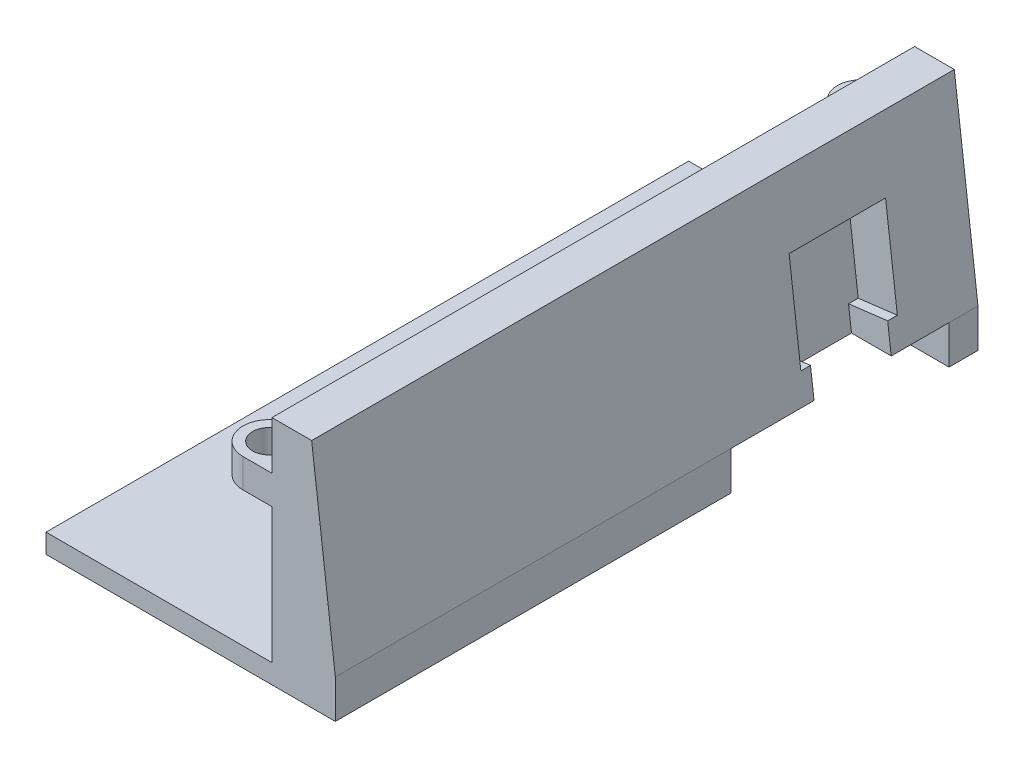
from build123d import *

# Parameters (mm, degrees)
EXTRUDE_1_DEPTH     = 3
EXTRUDE_2_DEPTH     = 66.63
CUT_EXTRUDE_1_DEPTH = 69.53372087
SKETCH_4_W          = 8
SKETCH_4_H          = 3
CUT_EXTRUDE_2_DEPTH = 10
SKETCH_5_W          = 6.574056315
SKETCH_5_H          = 41
SKETCH_5_H_2        = 3
EXTRUDE_3_DEPTH     = 2
SKETCH_6_W          = 20
SKETCH_6_H          = 22.63
SKETCH_6_W_2        = 30
SKETCH_6_H_2        = 41
SKETCH_6_H_3        = 3
EXTRUDE_4_DEPTH     = 2


with BuildPart() as part:
    # 草图1 → 凸台-拉伸1 (new body)
    with BuildSketch(Plane(origin=(0, 0, 0), x_dir=(1, 0, 0), z_dir=(0, 1, 0))):
        with BuildLine():
            ThreePointArc((2.75, -61.38), (1.944543648, -59.435456352), (0, -58.63))
            Line((0, -58.63), (0, -59.63))
            ThreePointArc((0, -59.63), (1.237436867, -60.142563133), (1.75, -61.38))
            ThreePointArc((1.75, -61.38), (1.237436867, -62.617436867), (0, -63.13))
            Line((0, -63.13), (0, -64.13))
            ThreePointArc((0, -64.13), (1.944543648, -63.324543648), (2.75, -61.38))
        make_face()
        with BuildLine():
            Line((0, -59.63), (0, -58.63))
            ThreePointArc((0, -58.63), (-2.75, -61.38), (0, -64.13))
            Line((0, -64.13), (0, -63.13))
            ThreePointArc((0, -63.13), (-1.75, -61.38), (0, -59.63))
        make_face()
        with BuildLine():
            Line((5, -58.63), (0, -58.63))
            ThreePointArc((0, -58.63), (1.944543648, -59.435456352), (2.75, -61.38))
            ThreePointArc((2.75, -61.38), (1.944543648, -63.324543648), (0, -64.13))
            Line((0, -64.13), (5, -64.13))
            Line((5, -64.13), (5, -58.63))
        make_face()
        Polygon((5, -2.5), (5, -58.63), (5, -64.13), (8, -64.13), (8, 2.5), (5, 2.5), align=None)
        with BuildLine():
            ThreePointArc((0, 2.5), (-2.5, 0), (0, -2.5))
            Line((0, -2.5), (0, -1.75))
            ThreePointArc((0, -1.75), (-1.75, 0), (0, 1.75))
            Line((0, 1.75), (0, 2.5))
        make_face()
        with BuildLine():
            Line((0, -1.75), (0, -2.5))
            ThreePointArc((0, -2.5), (1.767766953, -1.767766953), (2.5, 0))
            ThreePointArc((2.5, 0), (1.767766953, 1.767766953), (0, 2.5))
            Line((0, 2.5), (0, 1.75))
            ThreePointArc((0, 1.75), (1.237436867, 1.237436867), (1.75, 0))
            ThreePointArc((1.75, 0), (1.237436867, -1.237436867), (0, -1.75))
        make_face()
        with BuildLine():
            Line((0, -2.5), (5, -2.5))
            Line((5, -2.5), (5, 2.5))
            Line((5, 2.5), (0, 2.5))
            ThreePointArc((0, 2.5), (1.767766953, 1.767766953), (2.5, 0))
            ThreePointArc((2.5, 0), (1.767766953, -1.767766953), (0, -2.5))
        make_face()
    extrude(amount=EXTRUDE_1_DEPTH)

    # 草图2 → 凸台-拉伸2 (add, through all)
    with BuildSketch(Plane.XY.offset(64.13)):
        Polygon((3, 3), (8, 3), (7.118365096, 8), (3, 8), align=None)
        Polygon((3, -12), (3, 3), (8, 3), (10.644904711, -12), align=None)
    extrude(amount=-EXTRUDE_2_DEPTH)

    # 草图3 → 切除-拉伸1 (cut, through all)
    with BuildSketch(Plane.XY.offset(64.13)):
        Polygon((10.468020954, -13.888439464), (9.574056315, -12), (7.118365096, 8), (7.997986879, 8.163017845), (13.179200704, -12.892022974), align=None)
    extrude(amount=-CUT_EXTRUDE_1_DEPTH, mode=Mode.SUBTRACT)

    # 草图4 → 切除-拉伸2 (cut)
    with BuildSketch(Plane(origin=(3.923131172, 0.481699938, 0), x_dir=(0, 0, -1), z_dir=(0.9925461516413224, 0.12186934340514417, 0))):
        Polygon((-5.5, -10.077337776), (-5.5, -0.077337776), (-15.5, -0.077337776), (-15.5, -10.077337776), (-14.5, -10.077337776), (-14.5, -7.077337776), (-6.5, -7.077337776), (-6.5, -10.077337776), align=None)
        with Locations((-10.5, -8.577337776)):
            Rectangle(SKETCH_4_W, SKETCH_4_H)
        with Locations((-10.5, -11.577337776)):
            Rectangle(SKETCH_4_W, SKETCH_4_H)
    extrude(amount=CUT_EXTRUDE_2_DEPTH, mode=Mode.SUBTRACT)

    # 草图5 → 凸台-拉伸3 (add)
    with BuildSketch(Plane(origin=(0, -12, 0), x_dir=(-1, 0, 0), z_dir=(0, -1, 0))):
        with Locations((-6.287028157, -43.63)):
            Rectangle(SKETCH_5_W, SKETCH_5_H)
        with Locations((-6.287028157, 1)):
            Rectangle(SKETCH_5_W, SKETCH_5_H_2)
    extrude(amount=EXTRUDE_3_DEPTH)

    # 草图6 → 凸台-拉伸4 (add)
    with BuildSketch(Plane(origin=(0, -14, 0), x_dir=(-1, 0, 0), z_dir=(0, -1, 0))):
        with Locations((10.425943685, -11.815)):
            Rectangle(SKETCH_6_W, SKETCH_6_H)
        with Locations((5.425943685, -43.63)):
            Rectangle(SKETCH_6_W_2, SKETCH_6_H_2)
        with Locations((5.425943685, 1)):
            Rectangle(SKETCH_6_W_2, SKETCH_6_H_3)
    extrude(amount=EXTRUDE_4_DEPTH)


solid = part.part
